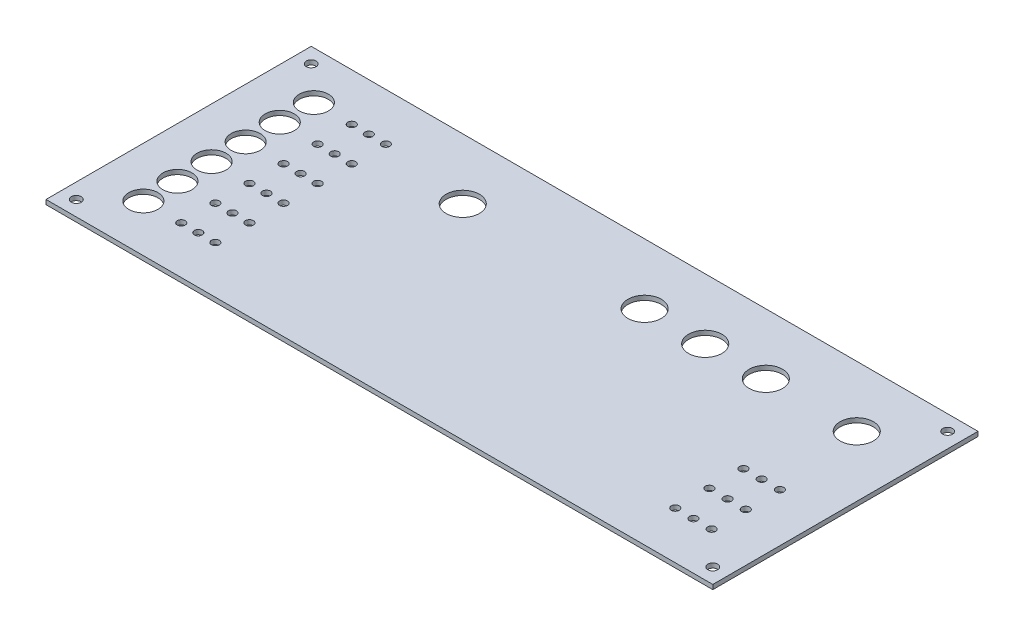
from build123d import *

# Parameters (mm, degrees)
SKETCH1_W           = 440
SKETCH1_H           = 175
SKETCH1_R           = 3.25
SKETCH1_R_2         = 9.6
SKETCH1_R_3         = 2.6
SKETCH1_R_4         = 11
BOSS_EXTRUDE1_DEPTH = 3


with BuildPart() as part:
    # Sketch1 → Boss-Extrude1 (new body)
    with BuildSketch(Plane(origin=(0, 0, 0), x_dir=(1, 0, 0), z_dir=(0, 1, 0))):
        with Locations((220, 87.5)):
            Rectangle(SKETCH1_W, SKETCH1_H)
        with Locations(Location((10, 10, 0), (0, 0, 270))):
            Circle(SKETCH1_R, mode=Mode.SUBTRACT)
        with Locations(Location((10, 165, 0), (0, 0, 270))):
            Circle(SKETCH1_R, mode=Mode.SUBTRACT)
        with Locations(Location((430, 165, 0), (0, 0, 270))):
            Circle(SKETCH1_R, mode=Mode.SUBTRACT)
        with Locations(Location((430, 10, 0), (0, 0, 270))):
            Circle(SKETCH1_R, mode=Mode.SUBTRACT)
        with Locations(Location((33, 31.25, 0), (0, 0, 270))):
            Circle(SKETCH1_R_2, mode=Mode.SUBTRACT)
        with Locations(Location((33, 53.75, 0), (0, 0, 270))):
            Circle(SKETCH1_R_2, mode=Mode.SUBTRACT)
        with Locations(Location((33, 76.25, 0), (0, 0, 270))):
            Circle(SKETCH1_R_2, mode=Mode.SUBTRACT)
        with Locations(Location((33, 98.75, 0), (0, 0, 270))):
            Circle(SKETCH1_R_2, mode=Mode.SUBTRACT)
        with Locations(Location((33, 121.25, 0), (0, 0, 270))):
            Circle(SKETCH1_R_2, mode=Mode.SUBTRACT)
        with Locations(Location((33, 143.75, 0), (0, 0, 270))):
            Circle(SKETCH1_R_2, mode=Mode.SUBTRACT)
        with Locations(Location((58, 31.25, 0), (0, 0, 270))):
            Circle(SKETCH1_R_3, mode=Mode.SUBTRACT)
        with Locations(Location((58, 53.75, 0), (0, 0, 270))):
            Circle(SKETCH1_R_3, mode=Mode.SUBTRACT)
        with Locations(Location((58, 76.25, 0), (0, 0, 270))):
            Circle(SKETCH1_R_3, mode=Mode.SUBTRACT)
        with Locations(Location((58, 98.75, 0), (0, 0, 270))):
            Circle(SKETCH1_R_3, mode=Mode.SUBTRACT)
        with Locations(Location((58, 121.25, 0), (0, 0, 270))):
            Circle(SKETCH1_R_3, mode=Mode.SUBTRACT)
        with Locations(Location((58, 143.75, 0), (0, 0, 270))):
            Circle(SKETCH1_R_3, mode=Mode.SUBTRACT)
        with Locations(Location((69.25, 31.25, 0), (0, 0, 270))):
            Circle(SKETCH1_R_3, mode=Mode.SUBTRACT)
        with Locations(Location((69.25, 53.75, 0), (0, 0, 270))):
            Circle(SKETCH1_R_3, mode=Mode.SUBTRACT)
        with Locations(Location((69.25, 76.25, 0), (0, 0, 270))):
            Circle(SKETCH1_R_3, mode=Mode.SUBTRACT)
        with Locations(Location((69.25, 98.75, 0), (0, 0, 270))):
            Circle(SKETCH1_R_3, mode=Mode.SUBTRACT)
        with Locations(Location((69.25, 121.25, 0), (0, 0, 270))):
            Circle(SKETCH1_R_3, mode=Mode.SUBTRACT)
        with Locations(Location((69.25, 143.75, 0), (0, 0, 270))):
            Circle(SKETCH1_R_3, mode=Mode.SUBTRACT)
        with Locations(Location((80.5, 31.25, 0), (0, 0, 270))):
            Circle(SKETCH1_R_3, mode=Mode.SUBTRACT)
        with Locations(Location((80.5, 53.75, 0), (0, 0, 270))):
            Circle(SKETCH1_R_3, mode=Mode.SUBTRACT)
        with Locations(Location((80.5, 76.25, 0), (0, 0, 270))):
            Circle(SKETCH1_R_3, mode=Mode.SUBTRACT)
        with Locations(Location((80.5, 98.75, 0), (0, 0, 270))):
            Circle(SKETCH1_R_3, mode=Mode.SUBTRACT)
        with Locations(Location((80.5, 121.25, 0), (0, 0, 270))):
            Circle(SKETCH1_R_3, mode=Mode.SUBTRACT)
        with Locations(Location((80.5, 143.75, 0), (0, 0, 270))):
            Circle(SKETCH1_R_3, mode=Mode.SUBTRACT)
        with Locations(Location((400, 135, 0), (0, 0, 270))):
            Circle(SKETCH1_R_4, mode=Mode.SUBTRACT)
        with Locations(Location((340, 135, 0), (0, 0, 270))):
            Circle(SKETCH1_R_4, mode=Mode.SUBTRACT)
        with Locations(Location((300, 135, 0), (0, 0, 270))):
            Circle(SKETCH1_R_4, mode=Mode.SUBTRACT)
        with Locations(Location((260, 135, 0), (0, 0, 270))):
            Circle(SKETCH1_R_4, mode=Mode.SUBTRACT)
        with Locations(Location((140, 135, 0), (0, 0, 270))):
            Circle(SKETCH1_R_4, mode=Mode.SUBTRACT)
        with Locations(Location((408, 31.25, 0), (0, 0, 270))):
            Circle(SKETCH1_R_3, mode=Mode.SUBTRACT)
        with Locations(Location((396, 31.25, 0), (0, 0, 270))):
            Circle(SKETCH1_R_3, mode=Mode.SUBTRACT)
        with Locations(Location((384, 31.25, 0), (0, 0, 270))):
            Circle(SKETCH1_R_3, mode=Mode.SUBTRACT)
        with Locations(Location((408, 53.75, 0), (0, 0, 270))):
            Circle(SKETCH1_R_3, mode=Mode.SUBTRACT)
        with Locations(Location((396, 53.75, 0), (0, 0, 270))):
            Circle(SKETCH1_R_3, mode=Mode.SUBTRACT)
        with Locations(Location((384, 53.75, 0), (0, 0, 270))):
            Circle(SKETCH1_R_3, mode=Mode.SUBTRACT)
        with Locations(Location((408, 76.25, 0), (0, 0, 270))):
            Circle(SKETCH1_R_3, mode=Mode.SUBTRACT)
        with Locations(Location((396, 76.25, 0), (0, 0, 270))):
            Circle(SKETCH1_R_3, mode=Mode.SUBTRACT)
        with Locations(Location((384, 76.25, 0), (0, 0, 270))):
            Circle(SKETCH1_R_3, mode=Mode.SUBTRACT)
    extrude(amount=BOSS_EXTRUDE1_DEPTH)


solid = part.part
